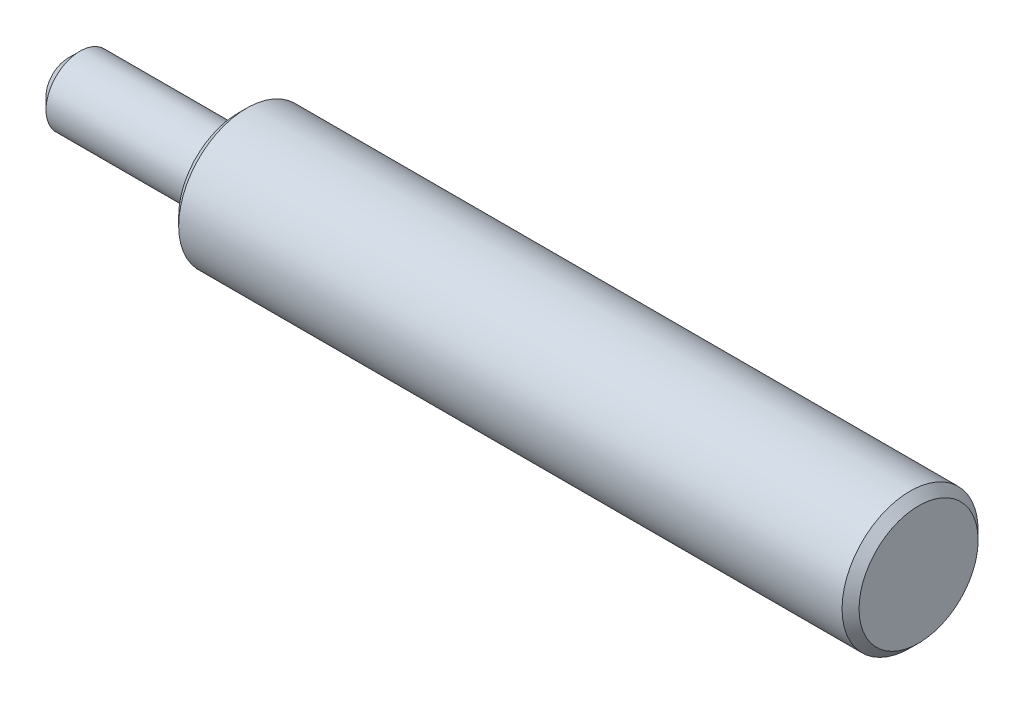
from build123d import *


with BuildPart() as part:
    # Sketch1 → Revolve1 (revolve)
    with BuildSketch(Plane.XY, mode=Mode.PRIVATE) as revolve1_sk:
        with BuildLine():
            Line((-10, 0), (-10, 1.3))
            Line((-10, 1.3), (-9.3, 2))
            Line((-9.3, 2), (-0.3, 2))
            ThreePointArc((-0.3, 2), (-0.087867966, 2.087867966), (0, 2.3))
            Line((0, 2.3), (0, 3.5))
            Line((0, 3.5), (0.5, 4))
            Line((0.5, 4), (39.5, 4))
            Line((39.5, 4), (40, 3.5))
            Line((40, 3.5), (40, 0))
            Line((40, 0), (-10, 0))
        make_face()
    revolve(revolve1_sk.sketch.rotate(Axis((40, 0, 0), (-1, 0, 0)), 270), axis=Axis((40, 0, 0), (-1, 0, 0)))


solid = part.part
